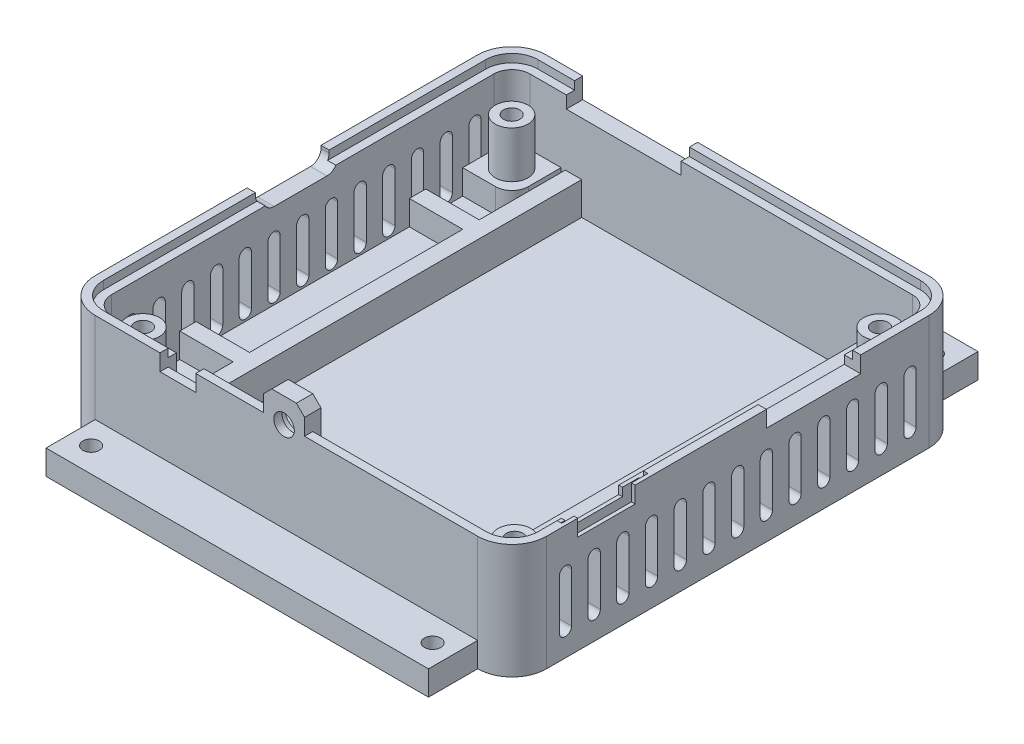
from build123d import *

# Parameters (mm, degrees)
BOSS_EXTRUDE1_DEPTH  = 14
BOSS_EXTRUDE2_DEPTH  = 13
BOSS_EXTRUDE4_DEPTH  = 2
SKETCH4_W            = 14
SKETCH4_H            = 2.5
CUT_EXTRUDE1_DEPTH   = 2
CUT_EXTRUDE3_DEPTH   = 2
SKETCH7_R            = 1.25
CUT_EXTRUDE4_DEPTH   = 2
BOSS_EXTRUDE6_DEPTH  = 3
SKETCH2_7_R          = 1
BOSS_EXTRUDE9_DEPTH  = 5
SKETCH11_R           = 2
SKETCH11_R_2         = 1
BOSS_EXTRUDE10_DEPTH = 5.68
BOSS_EXTRUDE11_DEPTH = 2
SKETCH15_W           = 0.750971698
SKETCH15_H           = 1
BOSS_EXTRUDE13_DEPTH = 1
SKETCH8_R            = 2
CUT_EXTRUDE5_DEPTH   = 1
SKETCH16_W           = 34
SKETCH16_H           = 51
CUT_EXTRUDE6_DEPTH   = 1
SKETCH17_R           = 2
CUT_EXTRUDE7_DEPTH   = 4
CUT_EXTRUDE9_DEPTH   = 2
CUT_EXTRUDE10_START  = -2
CUT_EXTRUDE10_DEPTH  = 2
SKETCH21_W           = 4.36
SKETCH21_H           = 2
CUT_EXTRUDE11_DEPTH  = 2
SKETCH23_W           = 4.36
SKETCH23_H           = 6.5
CUT_EXTRUDE12_DEPTH  = 1
SKETCH24_W           = 7
SKETCH24_H           = 2
SKETCH24_W_2         = 11.5
CUT_EXTRUDE13_DEPTH  = 2
SKETCH26_W           = 1.1
SKETCH26_H           = 10.5
CUT_EXTRUDE14_DEPTH  = 4
CHAMFER1_SIZE        = 1
SKETCH28_W           = 46.63
SKETCH28_H           = 3
BOSS_EXTRUDE14_DEPTH = 6
SKETCH29_W           = 46.63
SKETCH29_H           = 3
BOSS_EXTRUDE15_DEPTH = 6
SKETCH30_R           = 1
CUT_EXTRUDE15_DEPTH  = 3


with BuildPart() as part:
    # Sketch2 → Boss-Extrude1 (new body)
    with BuildSketch(Plane(origin=(0, 0, 0), x_dir=(1, 0, 0), z_dir=(0, 1, 0))):
        with BuildLine():
            ThreePointArc((-23.315, 27.5), (-26.284848481, 26.269848481), (-27.515, 23.3))
            Line((-27.515, 23.3), (-27.515, -23.3))
            ThreePointArc((-27.515, -23.3), (-26.284848481, -26.269848481), (-23.315, -27.5))
            Line((-23.315, -27.5), (23.315, -27.5))
            ThreePointArc((23.315, -27.5), (26.284848481, -26.269848481), (27.515, -23.3))
            Line((27.515, -23.3), (27.515, 23.3))
            ThreePointArc((27.515, 23.3), (26.284848481, 26.269848481), (23.315, 27.5))
            Line((23.315, 27.5), (-23.315, 27.5))
        make_face()
        with BuildLine():
            Line((-26.515, -23.3), (-26.515, 23.3))
            ThreePointArc((-26.515, 23.3), (-25.5777417, 25.5627417), (-23.315, 26.5))
            Line((-23.315, 26.5), (23.315, 26.5))
            ThreePointArc((23.315, 26.5), (25.5777417, 25.5627417), (26.515, 23.3))
            Line((26.515, 23.3), (26.515, -23.3))
            ThreePointArc((26.515, -23.3), (25.5777417, -25.5627417), (23.315, -26.5))
            Line((23.315, -26.5), (-23.315, -26.5))
            ThreePointArc((-23.315, -26.5), (-25.5777417, -25.5627417), (-26.515, -23.3))
        make_face(mode=Mode.SUBTRACT)
    extrude(amount=BOSS_EXTRUDE1_DEPTH)

    # Sketch2<3> → Boss-Extrude2 (add)
    with BuildSketch(Plane(origin=(0, 0, 0), x_dir=(1, 0, 0), z_dir=(0, 1, 0))):
        with BuildLine():
            ThreePointArc((-23.315, 26.5), (-25.5777417, 25.5627417), (-26.515, 23.3))
            Line((-26.515, 23.3), (-26.515, -23.3))
            ThreePointArc((-26.515, -23.3), (-25.5777417, -25.5627417), (-23.315, -26.5))
            Line((-23.315, -26.5), (23.315, -26.5))
            ThreePointArc((23.315, -26.5), (25.5777417, -25.5627417), (26.515, -23.3))
            Line((26.515, -23.3), (26.515, 23.3))
            ThreePointArc((26.515, 23.3), (25.5777417, 25.5627417), (23.315, 26.5))
            Line((23.315, 26.5), (-23.315, 26.5))
        make_face()
        with BuildLine():
            ThreePointArc((-25.515, 23.3), (-24.870634919, 24.855634919), (-23.315, 25.5))
            Line((-23.315, 25.5), (-19.515, 25.5))
            Line((-19.515, 25.5), (19.515, 25.5))
            Line((19.515, 25.5), (23.315, 25.5))
            ThreePointArc((23.315, 25.5), (24.870634919, 24.855634919), (25.515, 23.3))
            Line((25.515, 23.3), (25.515, 19.5))
            Line((25.515, 19.5), (25.515, -19.5))
            Line((25.515, -19.5), (25.515, -23.3))
            ThreePointArc((25.515, -23.3), (24.870634919, -24.855634919), (23.315, -25.5))
            Line((23.315, -25.5), (19.515, -25.5))
            Line((19.515, -25.5), (-19.515, -25.5))
            Line((-19.515, -25.5), (-23.315, -25.5))
            ThreePointArc((-23.315, -25.5), (-24.870634919, -24.855634919), (-25.515, -23.3))
            Line((-25.515, -23.3), (-25.515, -19.5))
            Line((-25.515, -19.5), (-25.515, 19.5))
            Line((-25.515, 19.5), (-25.515, 23.3))
        make_face(mode=Mode.SUBTRACT)
    extrude(amount=BOSS_EXTRUDE2_DEPTH)

    # Sketch2<5> → Boss-Extrude4 (add)
    with BuildSketch(Plane(origin=(0, 0, 0), x_dir=(1, 0, 0), z_dir=(0, 1, 0))):
        with BuildLine():
            Line((19.515, 25.5), (-19.515, 25.5))
            Line((-19.515, 25.5), (-19.515, 21.5))
            ThreePointArc((-19.515, 21.5), (-20.100786438, 20.085786438), (-21.515, 19.5))
            Line((-21.515, 19.5), (-25.515, 19.5))
            Line((-25.515, 19.5), (-25.515, -19.5))
            Line((-25.515, -19.5), (-21.515, -19.5))
            ThreePointArc((-21.515, -19.5), (-20.100786438, -20.085786438), (-19.515, -21.5))
            Line((-19.515, -21.5), (-19.515, -25.5))
            Line((-19.515, -25.5), (19.515, -25.5))
            Line((19.515, -25.5), (19.515, -21.5))
            ThreePointArc((19.515, -21.5), (20.100786438, -20.085786438), (21.515, -19.5))
            Line((21.515, -19.5), (25.515, -19.5))
            Line((25.515, -19.5), (25.515, 19.5))
            Line((25.515, 19.5), (21.515, 19.5))
            ThreePointArc((21.515, 19.5), (20.100786438, 20.085786438), (19.515, 21.5))
            Line((19.515, 21.5), (19.515, 25.5))
        make_face()
    extrude(amount=BOSS_EXTRUDE4_DEPTH)

    # Sketch4 → Cut-Extrude1 (cut)
    with BuildSketch(Plane(origin=(0, 0, -27.5), x_dir=(-1, 0, 0), z_dir=(0, 0, -1))):
        with Locations((11.875, 12.75)):
            Rectangle(SKETCH4_W, SKETCH4_H)
    extrude(amount=-CUT_EXTRUDE1_DEPTH, mode=Mode.SUBTRACT)

    # Sketch6 → Cut-Extrude3 (cut)
    with BuildSketch(Plane.ZY.offset(27.515)):
        with BuildLine():
            Line((-4.225, 14), (4.775, 14))
            Line((4.775, 14), (4.775, 13.68))
            ThreePointArc((4.775, 13.68), (4.40009668, 12.77490332), (3.495, 12.4))
            Line((3.495, 12.4), (-2.945, 12.4))
            ThreePointArc((-2.945, 12.4), (-3.85009668, 12.77490332), (-4.225, 13.68))
            Line((-4.225, 13.68), (-4.225, 14))
        make_face()
    extrude(amount=-CUT_EXTRUDE3_DEPTH, mode=Mode.SUBTRACT)

    # Sketch7 → Cut-Extrude4 (cut)
    with BuildSketch(Plane.XY.offset(27.5)):
        with Locations((-0.29, 13.97)):
            Circle(SKETCH7_R)
    extrude(amount=-CUT_EXTRUDE4_DEPTH, mode=Mode.SUBTRACT)

    # Sketch9 → Boss-Extrude6 (add)
    with BuildSketch(Plane(origin=(0, 2, 0), x_dir=(1, 0, 0), z_dir=(0, 1, 0))):
        Polygon((-17, 25.5), (-17, -25.5), (-19, -25.5), (-19, -15), (-25.515, -15), (-25.515, -13), (-19, -13), (-19, 13), (-25.515, 13), (-25.515, 15), (-19, 15), (-19, 25.5), align=None)
        Polygon((17, 25.5), (17, -25.5), (19, -25.5), (19, -15), (25.515, -15), (25.515, -13), (19, -13), (19, 13), (25.515, 13), (25.515, 15), (19, 15), (19, 25.5), align=None)
    extrude(amount=BOSS_EXTRUDE6_DEPTH)

    # Sketch2<7> → Boss-Extrude9 (add)
    # profile 1 of 4: a face of its own
    with BuildSketch(Plane(origin=(0, 0, 0), x_dir=(1, 0, 0), z_dir=(0, 1, 0))):
        with BuildLine():
            Line((-19.515, 25.5), (-23.315, 25.5))
            ThreePointArc((-23.315, 25.5), (-24.870634919, 24.855634919), (-25.515, 23.3))
            Line((-25.515, 23.3), (-25.515, 19.5))
            Line((-25.515, 19.5), (-21.515, 19.5))
            ThreePointArc((-21.515, 19.5), (-20.100786438, 20.085786438), (-19.515, 21.5))
            Line((-19.515, 21.5), (-19.515, 25.5))
        make_face()
        with Locations((-22.455, 22.41)):
            Circle(SKETCH2_7_R, mode=Mode.SUBTRACT)
    # profile 2 of 4: a face of its own
    with BuildSketch(Plane(origin=(0, 0, 0), x_dir=(1, 0, 0), z_dir=(0, 1, 0))):
        with BuildLine():
            Line((23.315, 25.5), (19.515, 25.5))
            Line((19.515, 25.5), (19.515, 21.5))
            ThreePointArc((19.515, 21.5), (20.100786438, 20.085786438), (21.515, 19.5))
            Line((21.515, 19.5), (25.515, 19.5))
            Line((25.515, 19.5), (25.515, 23.3))
            ThreePointArc((25.515, 23.3), (24.870634919, 24.855634919), (23.315, 25.5))
        make_face()
        with Locations((22.445, 22.42)):
            Circle(SKETCH2_7_R, mode=Mode.SUBTRACT)
    # profile 3 of 4: a face of its own
    with BuildSketch(Plane(origin=(0, 0, 0), x_dir=(1, 0, 0), z_dir=(0, 1, 0))):
        with BuildLine():
            Line((-21.515, -19.5), (-25.515, -19.5))
            Line((-25.515, -19.5), (-25.515, -23.3))
            ThreePointArc((-25.515, -23.3), (-24.870634919, -24.855634919), (-23.315, -25.5))
            Line((-23.315, -25.5), (-19.515, -25.5))
            Line((-19.515, -25.5), (-19.515, -21.5))
            ThreePointArc((-19.515, -21.5), (-20.100786438, -20.085786438), (-21.515, -19.5))
        make_face()
        with Locations((-22.495, -22.49)):
            Circle(SKETCH2_7_R, mode=Mode.SUBTRACT)
    # profile 4 of 4: a face of its own
    with BuildSketch(Plane(origin=(0, 0, 0), x_dir=(1, 0, 0), z_dir=(0, 1, 0))):
        with BuildLine():
            Line((25.515, -23.3), (25.515, -19.5))
            Line((25.515, -19.5), (21.515, -19.5))
            ThreePointArc((21.515, -19.5), (20.100786438, -20.085786438), (19.515, -21.5))
            Line((19.515, -21.5), (19.515, -25.5))
            Line((19.515, -25.5), (23.315, -25.5))
            ThreePointArc((23.315, -25.5), (24.870634919, -24.855634919), (25.515, -23.3))
        make_face()
        with Locations((22.425, -22.11)):
            Circle(SKETCH2_7_R, mode=Mode.SUBTRACT)
    extrude(amount=BOSS_EXTRUDE9_DEPTH)

    # Sketch11 → Boss-Extrude10 (add)
    # profile 1 of 4: a face of its own
    with BuildSketch(Plane(origin=(0, 5, 0), x_dir=(1, 0, 0), z_dir=(0, 1, 0))):
        with Locations((-22.455, 22.41)):
            Circle(SKETCH11_R)
        with Locations((-22.455, 22.41)):
            Circle(SKETCH11_R_2, mode=Mode.SUBTRACT)
    # profile 2 of 4: a face of its own
    with BuildSketch(Plane(origin=(0, 5, 0), x_dir=(1, 0, 0), z_dir=(0, 1, 0))):
        with Locations((22.445, 22.42)):
            Circle(SKETCH11_R)
        with Locations((22.445, 22.42)):
            Circle(SKETCH11_R_2, mode=Mode.SUBTRACT)
    # profile 3 of 4: a face of its own
    with BuildSketch(Plane(origin=(0, 5, 0), x_dir=(1, 0, 0), z_dir=(0, 1, 0))):
        with Locations((-22.495, -22.49)):
            Circle(SKETCH11_R)
        with Locations((-22.495, -22.49)):
            Circle(SKETCH11_R_2, mode=Mode.SUBTRACT)
    # profile 4 of 4: a face of its own
    with BuildSketch(Plane(origin=(0, 5, 0), x_dir=(1, 0, 0), z_dir=(0, 1, 0))):
        with Locations((22.425, -22.11)):
            Circle(SKETCH11_R)
        with Locations((22.425, -22.11)):
            Circle(SKETCH11_R_2, mode=Mode.SUBTRACT)
    extrude(amount=BOSS_EXTRUDE10_DEPTH)

    # Sketch13 → Boss-Extrude11 (add)
    with BuildSketch(Plane.XY.offset(27.5)):
        with BuildLine():
            Line((-2.79, 17), (2.21, 17))
            Line((2.21, 17), (2.21, 14))
            Line((2.21, 14), (0.959639948, 14))
            ThreePointArc((0.959639948, 14), (-0.29, 15.22), (-1.539639948, 14))
            Line((-1.539639948, 14), (-2.79, 14))
            Line((-2.79, 14), (-2.79, 17))
        make_face()
    extrude(amount=-BOSS_EXTRUDE11_DEPTH)

    # Sketch15 → Boss-Extrude13 (add)
    with BuildSketch(Plane(origin=(0, 0, 26.5), x_dir=(-1, 0, 0), z_dir=(0, 0, -1))):
        with Locations((-1.834514151, 13.5)):
            Rectangle(SKETCH15_W, SKETCH15_H)
        with Locations((2.414514151, 13.5)):
            Rectangle(SKETCH15_W, SKETCH15_H)
    extrude(amount=BOSS_EXTRUDE13_DEPTH)

    # Sketch8 → Cut-Extrude5 (cut)
    with BuildSketch(Plane(origin=(0, 0, 25.5), x_dir=(-1, 0, 0), z_dir=(0, 0, -1))):
        with Locations((0.29, 13.97)):
            Circle(SKETCH8_R)
    extrude(amount=-CUT_EXTRUDE5_DEPTH, mode=Mode.SUBTRACT)

    # Sketch16 → Cut-Extrude6 (cut)
    with BuildSketch(Plane(origin=(0, 2, 0), x_dir=(1, 0, 0), z_dir=(0, 1, 0))):
        Rectangle(SKETCH16_W, SKETCH16_H)
    extrude(amount=-CUT_EXTRUDE6_DEPTH, mode=Mode.SUBTRACT)

    # Sketch17 → Cut-Extrude7 (cut)
    with BuildSketch(Plane.XZ):
        with Locations((-22.495, 22.49)):
            Circle(SKETCH17_R)
        with Locations((22.425, 22.11)):
            Circle(SKETCH17_R)
        with Locations((-22.455, -22.41)):
            Circle(SKETCH17_R)
        with Locations((22.445, -22.42)):
            Circle(SKETCH17_R)
    extrude(amount=-CUT_EXTRUDE7_DEPTH, mode=Mode.SUBTRACT)

    # Sketch19 → Cut-Extrude9 (cut)
    with BuildSketch(Plane(origin=(27.515, 0, 0), x_dir=(0, 0, -1), z_dir=(1, 0, 0))):
        with BuildLine():
            Line((-21.75, 9), (-21.75, 3))
            ThreePointArc((-21.75, 3), (-21, 2.25), (-20.25, 3))
            Line((-20.25, 3), (-20.25, 9))
            ThreePointArc((-20.25, 9), (-21, 9.75), (-21.75, 9))
        make_face()
        with BuildLine():
            Line((-18.25, 9), (-18.25, 3))
            ThreePointArc((-18.25, 3), (-17.5, 2.25), (-16.75, 3))
            Line((-16.75, 3), (-16.75, 9))
            ThreePointArc((-16.75, 9), (-17.5, 9.75), (-18.25, 9))
        make_face()
        with BuildLine():
            Line((-14.75, 9), (-14.75, 3))
            ThreePointArc((-14.75, 3), (-14, 2.25), (-13.25, 3))
            Line((-13.25, 3), (-13.25, 9))
            ThreePointArc((-13.25, 9), (-14, 9.75), (-14.75, 9))
        make_face()
        with BuildLine():
            Line((-11.25, 9), (-11.25, 3))
            ThreePointArc((-11.25, 3), (-10.5, 2.25), (-9.75, 3))
            Line((-9.75, 3), (-9.75, 9))
            ThreePointArc((-9.75, 9), (-10.5, 9.75), (-11.25, 9))
        make_face()
        with BuildLine():
            Line((-7.75, 9), (-7.75, 3))
            ThreePointArc((-7.75, 3), (-7, 2.25), (-6.25, 3))
            Line((-6.25, 3), (-6.25, 9))
            ThreePointArc((-6.25, 9), (-7, 9.75), (-7.75, 9))
        make_face()
        with BuildLine():
            Line((-4.25, 9), (-4.25, 3))
            ThreePointArc((-4.25, 3), (-3.5, 2.25), (-2.75, 3))
            Line((-2.75, 3), (-2.75, 9))
            ThreePointArc((-2.75, 9), (-3.5, 9.75), (-4.25, 9))
        make_face()
        with BuildLine():
            Line((-0.75, 9), (-0.75, 3))
            ThreePointArc((-0.75, 3), (0, 2.25), (0.75, 3))
            Line((0.75, 3), (0.75, 9))
            ThreePointArc((0.75, 9), (0, 9.75), (-0.75, 9))
        make_face()
        with BuildLine():
            Line((2.75, 9), (2.75, 3))
            ThreePointArc((2.75, 3), (3.5, 2.25), (4.25, 3))
            Line((4.25, 3), (4.25, 9))
            ThreePointArc((4.25, 9), (3.5, 9.75), (2.75, 9))
        make_face()
        with BuildLine():
            Line((6.25, 9), (6.25, 3))
            ThreePointArc((6.25, 3), (7, 2.25), (7.75, 3))
            Line((7.75, 3), (7.75, 9))
            ThreePointArc((7.75, 9), (7, 9.75), (6.25, 9))
        make_face()
        with BuildLine():
            Line((9.75, 9), (9.75, 3))
            ThreePointArc((9.75, 3), (10.5, 2.25), (11.25, 3))
            Line((11.25, 3), (11.25, 9))
            ThreePointArc((11.25, 9), (10.5, 9.75), (9.75, 9))
        make_face()
        with BuildLine():
            Line((13.25, 9), (13.25, 3))
            ThreePointArc((13.25, 3), (14, 2.25), (14.75, 3))
            Line((14.75, 3), (14.75, 9))
            ThreePointArc((14.75, 9), (14, 9.75), (13.25, 9))
        make_face()
        with BuildLine():
            Line((16.75, 9), (16.75, 3))
            ThreePointArc((16.75, 3), (17.5, 2.25), (18.25, 3))
            Line((18.25, 3), (18.25, 9))
            ThreePointArc((18.25, 9), (17.5, 9.75), (16.75, 9))
        make_face()
        with BuildLine():
            Line((20.25, 9), (20.25, 3))
            ThreePointArc((20.25, 3), (21, 2.25), (21.75, 3))
            Line((21.75, 3), (21.75, 9))
            ThreePointArc((21.75, 9), (21, 9.75), (20.25, 9))
        make_face()
    extrude(amount=-CUT_EXTRUDE9_DEPTH, mode=Mode.SUBTRACT)

    # Sketch20 → Cut-Extrude10 (cut)
    with BuildSketch(Plane.ZY.offset(27.515).offset(CUT_EXTRUDE10_START)):
        with BuildLine():
            Line((-21.75, 9), (-21.75, 3))
            ThreePointArc((-21.75, 3), (-21, 2.25), (-20.25, 3))
            Line((-20.25, 3), (-20.25, 9))
            ThreePointArc((-20.25, 9), (-21, 9.75), (-21.75, 9))
        make_face()
        with BuildLine():
            Line((-18.25, 9), (-18.25, 3))
            ThreePointArc((-18.25, 3), (-17.5, 2.25), (-16.75, 3))
            Line((-16.75, 3), (-16.75, 9))
            ThreePointArc((-16.75, 9), (-17.5, 9.75), (-18.25, 9))
        make_face()
        with BuildLine():
            Line((-14.75, 9), (-14.75, 3))
            ThreePointArc((-14.75, 3), (-14, 2.25), (-13.25, 3))
            Line((-13.25, 3), (-13.25, 9))
            ThreePointArc((-13.25, 9), (-14, 9.75), (-14.75, 9))
        make_face()
        with BuildLine():
            Line((-11.25, 9), (-11.25, 3))
            ThreePointArc((-11.25, 3), (-10.5, 2.25), (-9.75, 3))
            Line((-9.75, 3), (-9.75, 9))
            ThreePointArc((-9.75, 9), (-10.5, 9.75), (-11.25, 9))
        make_face()
        with BuildLine():
            Line((-7.75, 9), (-7.75, 3))
            ThreePointArc((-7.75, 3), (-7, 2.25), (-6.25, 3))
            Line((-6.25, 3), (-6.25, 9))
            ThreePointArc((-6.25, 9), (-7, 9.75), (-7.75, 9))
        make_face()
        with BuildLine():
            Line((-4.25, 9), (-4.25, 3))
            ThreePointArc((-4.25, 3), (-3.5, 2.25), (-2.75, 3))
            Line((-2.75, 3), (-2.75, 9))
            ThreePointArc((-2.75, 9), (-3.5, 9.75), (-4.25, 9))
        make_face()
        with BuildLine():
            Line((-0.75, 9), (-0.75, 3))
            ThreePointArc((-0.75, 3), (0, 2.25), (0.75, 3))
            Line((0.75, 3), (0.75, 9))
            ThreePointArc((0.75, 9), (0, 9.75), (-0.75, 9))
        make_face()
        with BuildLine():
            Line((2.75, 9), (2.75, 3))
            ThreePointArc((2.75, 3), (3.5, 2.25), (4.25, 3))
            Line((4.25, 3), (4.25, 9))
            ThreePointArc((4.25, 9), (3.5, 9.75), (2.75, 9))
        make_face()
        with BuildLine():
            Line((6.25, 9), (6.25, 3))
            ThreePointArc((6.25, 3), (7, 2.25), (7.75, 3))
            Line((7.75, 3), (7.75, 9))
            ThreePointArc((7.75, 9), (7, 9.75), (6.25, 9))
        make_face()
        with BuildLine():
            Line((9.75, 9), (9.75, 3))
            ThreePointArc((9.75, 3), (10.5, 2.25), (11.25, 3))
            Line((11.25, 3), (11.25, 9))
            ThreePointArc((11.25, 9), (10.5, 9.75), (9.75, 9))
        make_face()
        with BuildLine():
            Line((13.25, 9), (13.25, 3))
            ThreePointArc((13.25, 3), (14, 2.25), (14.75, 3))
            Line((14.75, 3), (14.75, 9))
            ThreePointArc((14.75, 9), (14, 9.75), (13.25, 9))
        make_face()
        with BuildLine():
            Line((16.75, 9), (16.75, 3))
            ThreePointArc((16.75, 3), (17.5, 2.25), (18.25, 3))
            Line((18.25, 3), (18.25, 9))
            ThreePointArc((18.25, 9), (17.5, 9.75), (16.75, 9))
        make_face()
        with BuildLine():
            Line((20.25, 9), (20.25, 3))
            ThreePointArc((20.25, 3), (21, 2.25), (21.75, 3))
            Line((21.75, 3), (21.75, 9))
            ThreePointArc((21.75, 9), (21, 9.75), (20.25, 9))
        make_face()
    extrude(amount=CUT_EXTRUDE10_DEPTH, mode=Mode.SUBTRACT)

    # Sketch21 → Cut-Extrude11 (cut)
    with BuildSketch(Plane.XY.offset(27.5)):
        with Locations((-13.235, 13)):
            Rectangle(SKETCH21_W, SKETCH21_H)
    extrude(amount=-CUT_EXTRUDE11_DEPTH, mode=Mode.SUBTRACT)

    # Sketch23 → Cut-Extrude12 (cut)
    with BuildSketch(Plane(origin=(0, 0, 25.5), x_dir=(-1, 0, 0), z_dir=(0, 0, -1))):
        with Locations((13.235, 8.75)):
            Rectangle(SKETCH23_W, SKETCH23_H)
    extrude(amount=-CUT_EXTRUDE12_DEPTH, mode=Mode.SUBTRACT)

    # Sketch24 → Cut-Extrude13 (cut)
    with BuildSketch(Plane(origin=(27.515, 0, 0), x_dir=(0, 0, -1), z_dir=(1, 0, 0))):
        with Locations((-16, 13)):
            Rectangle(SKETCH24_W, SKETCH24_H)
        with Locations((9.25, 13)):
            Rectangle(SKETCH24_W_2, SKETCH24_H)
    extrude(amount=-CUT_EXTRUDE13_DEPTH, mode=Mode.SUBTRACT)

    # Sketch26 → Cut-Extrude14 (cut)
    with BuildSketch(Plane(origin=(0, 14, 0), x_dir=(1, 0, 0), z_dir=(0, 1, 0))):
        with Locations((26.515, -15.75)):
            Rectangle(SKETCH26_W, SKETCH26_H)
    extrude(amount=-CUT_EXTRUDE14_DEPTH, mode=Mode.SUBTRACT)

    # Chamfer1
    chamfer1_edges = [part.edges().sort_by_distance(p)[0] for p in [
        (-2.79, 17, 26.5),
        (2.21, 17, 26.5),
    ]]
    chamfer(chamfer1_edges, length=CHAMFER1_SIZE)

    # Sketch28 → Boss-Extrude14 (add)
    with BuildSketch(Plane.XY.offset(27.5)):
        with Locations((0, 1.5)):
            Rectangle(SKETCH28_W, SKETCH28_H)
    extrude(amount=BOSS_EXTRUDE14_DEPTH)

    # Sketch29 → Boss-Extrude15 (add)
    with BuildSketch(Plane(origin=(0, 0, -27.5), x_dir=(-1, 0, 0), z_dir=(0, 0, -1))):
        with Locations((0, 1.5)):
            Rectangle(SKETCH29_W, SKETCH29_H)
    extrude(amount=BOSS_EXTRUDE15_DEPTH)

    # Sketch30 → Cut-Extrude15 (cut)
    with BuildSketch(Plane(origin=(0, 3, 0), x_dir=(1, 0, 0), z_dir=(0, 1, 0))):
        with Locations((-20.815, -30.5)):
            Circle(SKETCH30_R)
        with Locations((20.815, -30.5)):
            Circle(SKETCH30_R)
        with Locations((-20.815, 30.5)):
            Circle(SKETCH30_R)
        with Locations((20.815, 30.5)):
            Circle(SKETCH30_R)
    extrude(amount=-CUT_EXTRUDE15_DEPTH, mode=Mode.SUBTRACT)


solid = part.part
